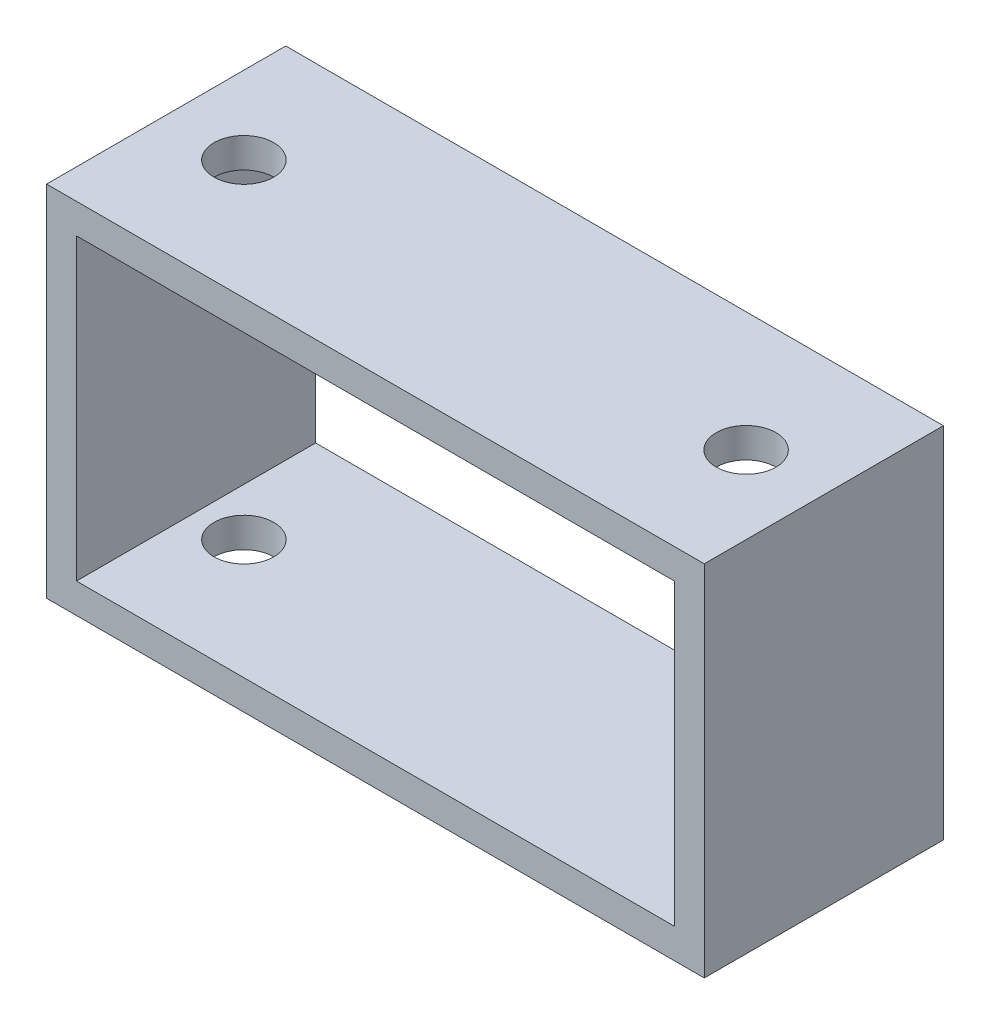
from build123d import *

# Parameters (mm, degrees)
SKETCH_1_W          = 55
SKETCH_1_H          = 20
EXTRUDE_1_DEPTH     = 30
CUT_EXTRUDE_1_REACH = 47.346
SKETCH_2_W          = 50
SKETCH_2_H          = 25
CUT_EXTRUDE_2_REACH = 43.908
SKETCH_3_R          = 2.5


with BuildPart() as part:
    # 草图1 → 凸台-拉伸1 (new body)
    with BuildSketch(Plane(origin=(0, 0, 0), x_dir=(1, 0, 0), z_dir=(0, 1, 0))):
        Rectangle(SKETCH_1_W, SKETCH_1_H)
    extrude(amount=EXTRUDE_1_DEPTH)

    # 草图2 → 切除-拉伸1 (cut, up to next)
    with BuildSketch(Plane.XY.offset(10), mode=Mode.PRIVATE) as cut_extrude_1_sk1:
        with Locations((0, 15)):
            Rectangle(SKETCH_2_W, SKETCH_2_H)
    cut_extrude_1_tool1 = extrude(cut_extrude_1_sk1.sketch, amount=-CUT_EXTRUDE_1_REACH, mode=Mode.PRIVATE) & part.part
    add(cut_extrude_1_tool1.solids().sort_by_distance((0, 15, 10))[0], mode=Mode.SUBTRACT)

    # 切除-拉伸2: up to this face of the body (flat: up to its plane)
    cut_extrude_2_end = Plane(part.part.faces().sort_by_distance((0, 0, 0))[0])
    # 草图3 → 切除-拉伸2 (cut, up to the picked face)
    with BuildSketch(Plane(origin=(0, 30, 0), x_dir=(1, 0, 0), z_dir=(0, 1, 0)), mode=Mode.PRIVATE) as cut_extrude_2_sk1:
        with Locations(Location((-21, 0, 0), (0, 0, 270))):
            Circle(SKETCH_3_R)
    cut_extrude_2_tool1 = split(extrude(cut_extrude_2_sk1.sketch, amount=-CUT_EXTRUDE_2_REACH, mode=Mode.PRIVATE), bisect_by=cut_extrude_2_end, keep=Keep.BOTH, mode=Mode.PRIVATE)
    # 草图3 → 切除-拉伸2 (cut, up to the picked face)
    with BuildSketch(Plane(origin=(0, 30, 0), x_dir=(1, 0, 0), z_dir=(0, 1, 0)), mode=Mode.PRIVATE) as cut_extrude_2_sk2:
        with Locations(Location((21, 0, 0), (0, 0, 270))):
            Circle(SKETCH_3_R)
    cut_extrude_2_tool2 = split(extrude(cut_extrude_2_sk2.sketch, amount=-CUT_EXTRUDE_2_REACH, mode=Mode.PRIVATE), bisect_by=cut_extrude_2_end, keep=Keep.BOTH, mode=Mode.PRIVATE)
    add(cut_extrude_2_tool1.solids().sort_by(Axis((-21, 30, 0), (0, -1, 0)))[0], mode=Mode.SUBTRACT)
    add(cut_extrude_2_tool2.solids().sort_by(Axis((21, 30, 0), (0, -1, 0)))[0], mode=Mode.SUBTRACT)


solid = part.part
